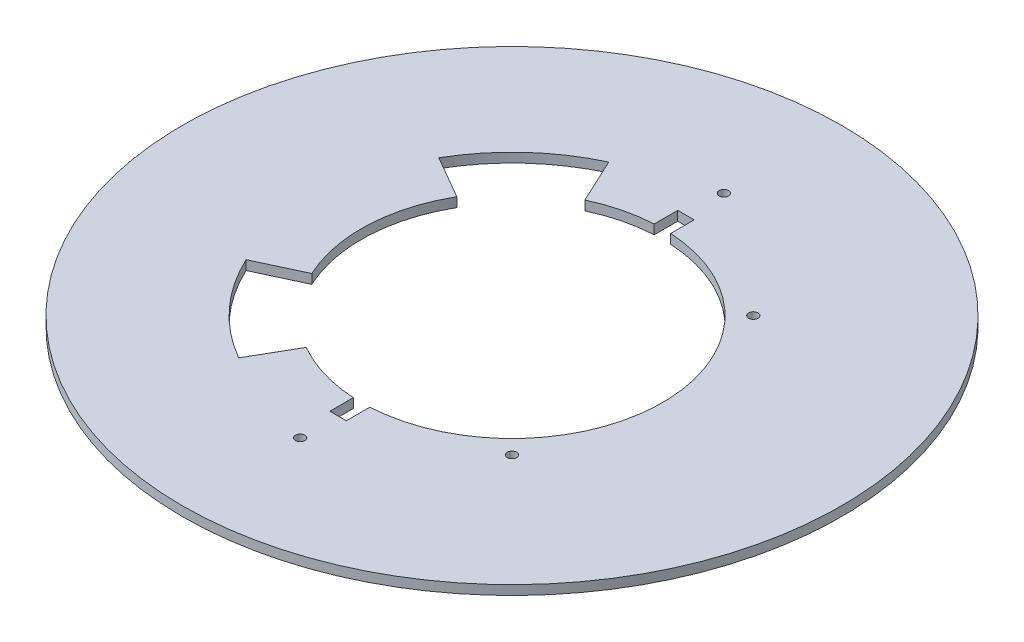
from build123d import *

# Parameters (mm, degrees)
SKETCH1_R           = 140
SKETCH1_R_2         = 64
BOSS_EXTRUDE1_DEPTH = 2
CUT_EXTRUDE1_DEPTH  = 199.030300712
SKETCH4_R           = 2
CUT_EXTRUDE2_DEPTH  = 199.030300712
SKETCH5_R           = 2
CUT_EXTRUDE3_DEPTH  = 199.030300712
SKETCH6_R           = 2
CUT_EXTRUDE4_DEPTH  = 199.030300712
CUT_EXTRUDE6_DEPTH  = 199.030300712


with BuildPart() as part:
    # Sketch1 → Boss-Extrude1 (new, symmetric)
    with BuildSketch(Plane(origin=(0, 0, 0), x_dir=(1, 0, 0), z_dir=(0, 1, 0))):
        with Locations(Location((0, 0, 0), (0, 0, 270))):
            Circle(SKETCH1_R)
        with Locations(Location((0, 0, 0), (0, 0, 270))):
            Circle(SKETCH1_R_2, mode=Mode.SUBTRACT)
    extrude(amount=BOSS_EXTRUDE1_DEPTH, both=True)

    # Sketch2 → Cut-Extrude1 (cut, through all)
    with BuildSketch(Plane(origin=(0, 2, 0), x_dir=(1, 0, 0), z_dir=(0, 1, 0))):
        with BuildLine():
            Line((-3.5, 73.904225212), (0, 73.904225212))
            Line((0, 73.904225212), (3.5, 73.904225212))
            Line((3.5, 73.904225212), (3.5, 63.904225212))
            ThreePointArc((3.5, 63.904225212), (0, 64), (-3.5, 63.904225212))
            Line((-3.5, 63.904225212), (-3.5, 73.904225212))
        make_face()
        with BuildLine():
            Line((3.5, -73.904225212), (3.5, -63.904225212))
            ThreePointArc((3.5, -63.904225212), (0, -64), (-3.5, -63.904225212))
            Line((-3.5, -63.904225212), (-3.5, -73.904225212))
            Line((-3.5, -73.904225212), (0, -73.904225212))
            Line((0, -73.904225212), (3.5, -73.904225212))
        make_face()
    extrude(amount=-CUT_EXTRUDE1_DEPTH, mode=Mode.SUBTRACT)

    # Sketch4 → Cut-Extrude2 (cut, through all)
    with BuildSketch(Plane(origin=(0, 2, 0), x_dir=(1, 0, 0), z_dir=(0, 1, 0))):
        with Locations(Location((-51.265241636, 51.265241636, 0), (0, 0, 270))):
            Circle(SKETCH4_R)
        with Locations(Location((51.265241636, -51.265241636, 0), (0, 0, 90))):
            Circle(SKETCH4_R)
    extrude(amount=-CUT_EXTRUDE2_DEPTH, mode=Mode.SUBTRACT)

    # Sketch5 → Cut-Extrude3 (cut, through all)
    with BuildSketch(Plane(origin=(0, 2, 0), x_dir=(1, 0, 0), z_dir=(0, 1, 0))):
        with Locations(Location((0, -90, 0), (0, 0, 270))):
            Circle(SKETCH5_R)
        with Locations(Location((0, 90, 0), (0, 0, 90))):
            Circle(SKETCH5_R)
    extrude(amount=-CUT_EXTRUDE3_DEPTH, mode=Mode.SUBTRACT)

    # Sketch6 → Cut-Extrude4 (cut, through all)
    with BuildSketch(Plane(origin=(0, 2, 0), x_dir=(1, 0, 0), z_dir=(0, 1, 0))):
        with Locations(Location((-51.265241636, -51.265241636, 0), (0, 0, 270))):
            Circle(SKETCH6_R)
        with Locations(Location((51.265241636, 51.265241636, 0), (0, 0, 90))):
            Circle(SKETCH6_R)
    extrude(amount=-CUT_EXTRUDE4_DEPTH, mode=Mode.SUBTRACT)

    # Sketch7 → Cut-Extrude6 (cut, through all)
    with BuildSketch(Plane(origin=(0, 2, 0), x_dir=(1, 0, 0), z_dir=(0, 1, 0))):
        with BuildLine():
            Line((-27.047568751, 58.00369837), (-35.922552248, 77.036161898))
            ThreePointArc((-35.922552248, 77.036161898), (-57.425167647, 62.668573629), (-73.612159322, 42.5))
            Line((-73.612159322, 42.5), (-55.425625842, 32))
            ThreePointArc((-55.425625842, 32), (-43.237773287, 47.185749556), (-27.047568751, 58.00369837))
        make_face()
        with BuildLine():
            Line((-58.00369837, -27.047568751), (-77.036161898, -35.922552248))
            ThreePointArc((-77.036161898, -35.922552248), (-62.668573629, -57.425167647), (-42.5, -73.612159322))
            Line((-42.5, -73.612159322), (-32, -55.425625842))
            ThreePointArc((-32, -55.425625842), (-47.185749556, -43.237773287), (-58.00369837, -27.047568751))
        make_face()
    extrude(amount=-CUT_EXTRUDE6_DEPTH, mode=Mode.SUBTRACT)


solid = part.part
